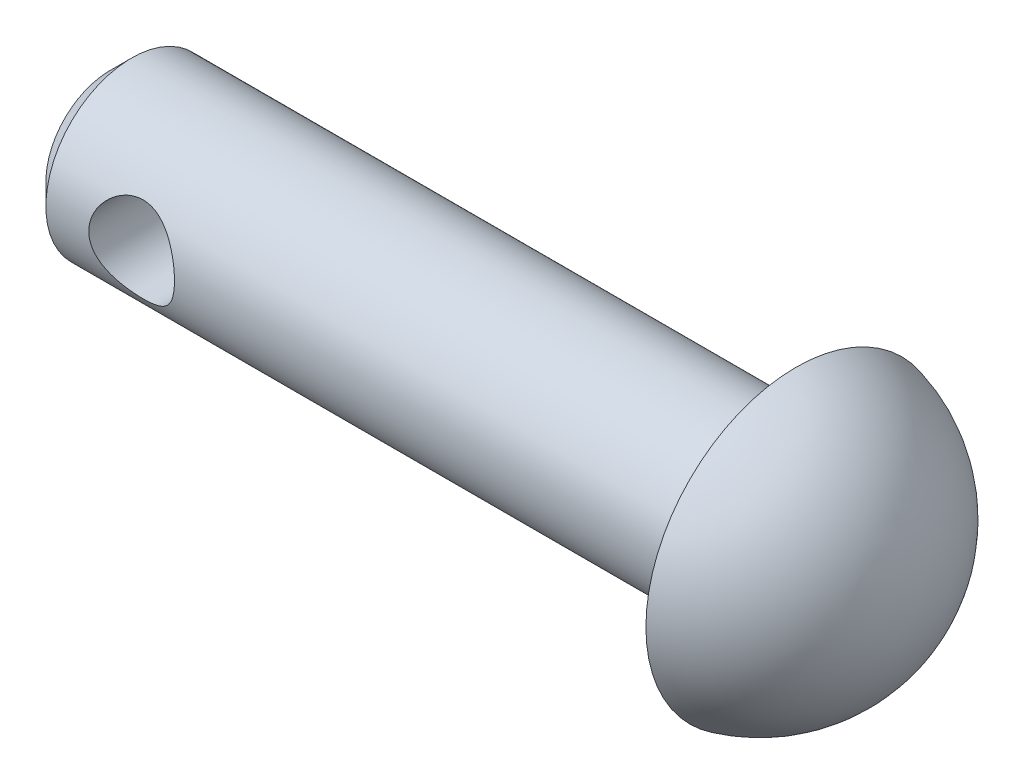
from build123d import *

# Parameters (mm, degrees)
SKETCH1_R           = 2
BOSS_EXTRUDE1_DEPTH = 16
SKETCH2_R           = 1
CUT_EXTRUDE1_DEPTH  = 8
CHAMFER1_SIZE       = 0.5


with BuildPart() as part:
    # Sketch1 → Boss-Extrude1 (new body)
    with BuildSketch(Plane(origin=(0, 0, 0), x_dir=(0, 0, -1), z_dir=(1, 0, 0))):
        Circle(SKETCH1_R)
    extrude(amount=-BOSS_EXTRUDE1_DEPTH)

    # Sketch2 → Cut-Extrude1 (cut, symmetric)
    with BuildSketch(Plane.XY):
        with Locations((-13.5, 0)):
            Circle(SKETCH2_R)
    extrude(amount=CUT_EXTRUDE1_DEPTH, both=True, mode=Mode.SUBTRACT)

    # Sketch3 → Revolve1 (revolve)
    with BuildSketch(Plane(origin=(0, 0, 0), x_dir=(1, 0, 0), z_dir=(0, 1, 0))):
        with BuildLine():
            Line((0, 3.5), (0, 0))
            Line((0, 0), (2.757385023, 0))
            ThreePointArc((2.757385023, 0), (1.985229955, 2.227844932), (0, 3.5))
        make_face()
    revolve(axis=Axis((-4.442614977, 0, 0), (1, 0, 0)))

    # Chamfer1
    chamfer1_edges = [part.edges().sort_by_distance(p)[0] for p in [
        (-16, 0, 2),
    ]]
    chamfer(chamfer1_edges, length=CHAMFER1_SIZE)


solid = part.part
